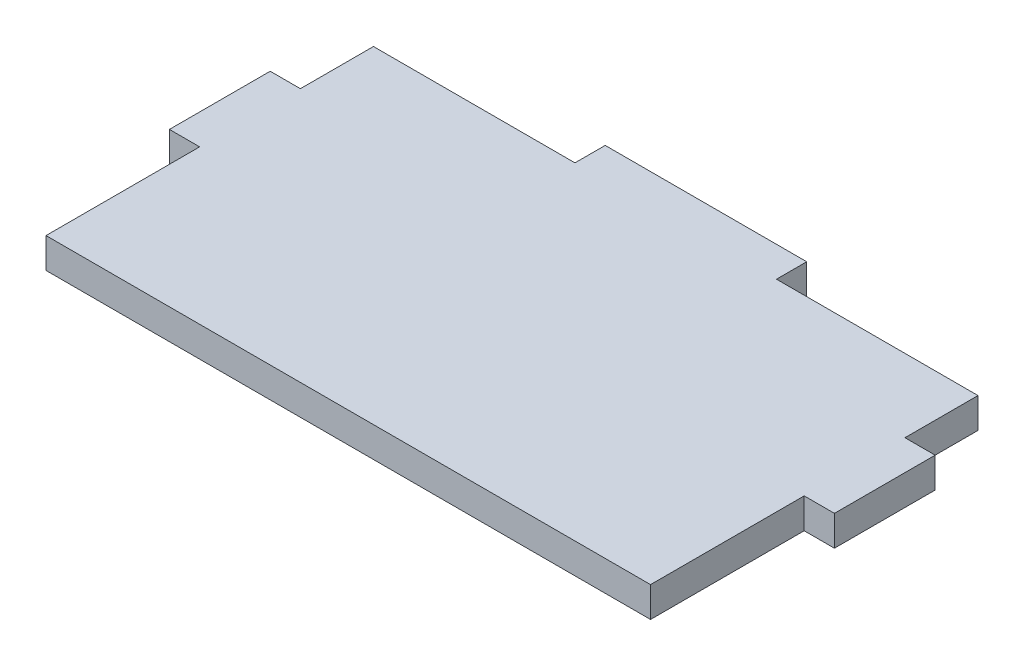
from build123d import *

# Parameters (mm, degrees)
SKETCH2_W           = 60
SKETCH2_H           = 35.5
BOSS_EXTRUDE1_DEPTH = 3
SKETCH3_W           = 3
SKETCH3_H           = 10
BOSS_EXTRUDE2_DEPTH = 3
SKETCH4_W           = 20
SKETCH4_H           = 3
CUT_EXTRUDE2_DEPTH  = 3


with BuildPart() as part:
    # Sketch2 → Boss-Extrude1 (new body)
    with BuildSketch(Plane(origin=(0, 0, 0), x_dir=(1, 0, 0), z_dir=(0, 1, 0))):
        Rectangle(SKETCH2_W, SKETCH2_H)
    extrude(amount=BOSS_EXTRUDE1_DEPTH)

    # Sketch3 → Boss-Extrude2 (add)
    with BuildSketch(Plane(origin=(0, 0, 0), x_dir=(1, 0, 0), z_dir=(0, 1, 0))):
        with Locations((-31.5, 2.5)):
            Rectangle(SKETCH3_W, SKETCH3_H)
        with Locations((31.5, 2.5)):
            Rectangle(SKETCH3_W, SKETCH3_H)
    extrude(amount=BOSS_EXTRUDE2_DEPTH)

    # Sketch4 → Cut-Extrude2 (cut)
    with BuildSketch(Plane(origin=(0, 3, 0), x_dir=(1, 0, 0), z_dir=(0, 1, 0))):
        with Locations((-20, 16.25)):
            Rectangle(SKETCH4_W, SKETCH4_H)
        with Locations((20, 16.25)):
            Rectangle(SKETCH4_W, SKETCH4_H)
    extrude(amount=-CUT_EXTRUDE2_DEPTH, mode=Mode.SUBTRACT)


solid = part.part
